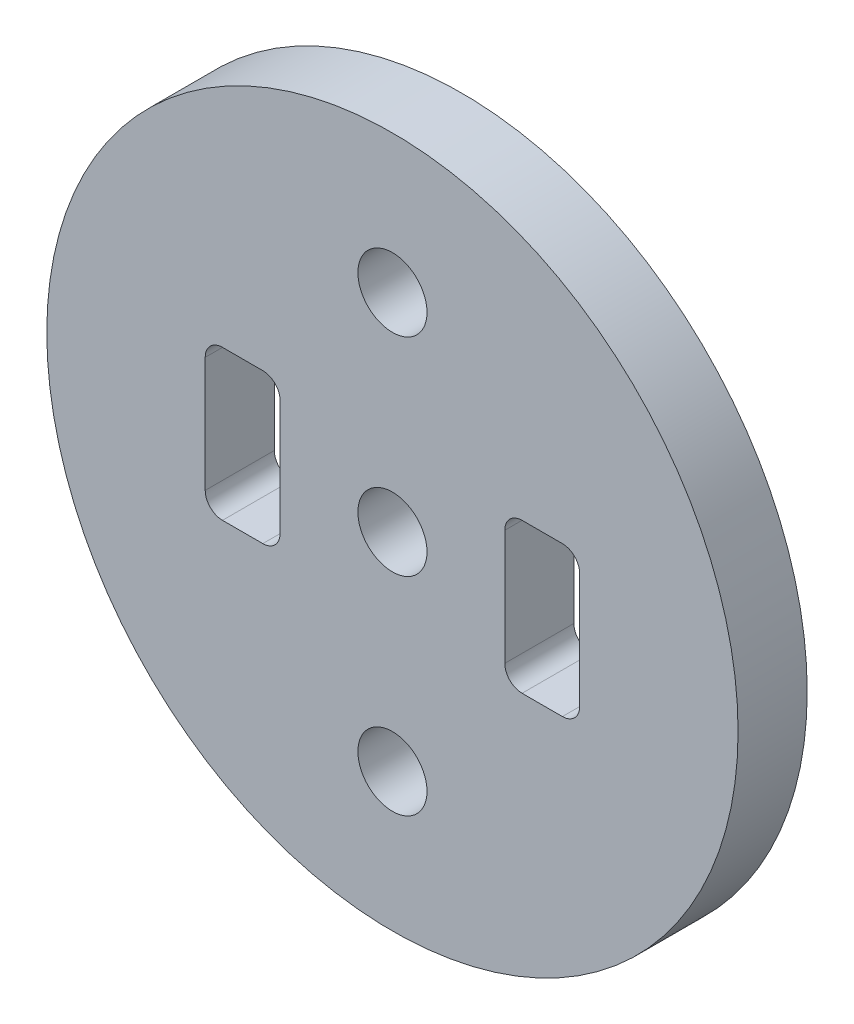
from build123d import *

# Parameters (mm, degrees)
MODEL_R                 = 15
MODEL_R_2               = 1.5
SALIENTE_EXTRUIR1_DEPTH = 3


with BuildPart() as part:
    # Model → Saliente-Extruir1 (new body)
    with BuildSketch(Plane.XY):
        with Locations((215.747807914, 241.952019993)):
            Circle(MODEL_R)
        with Locations((215.747807914, 241.952019993)):
            Circle(MODEL_R_2, mode=Mode.SUBTRACT)
        with Locations((215.747807914, 232.952019993)):
            Circle(MODEL_R_2, mode=Mode.SUBTRACT)
        with Locations((215.747807914, 250.952019993)):
            Circle(MODEL_R_2, mode=Mode.SUBTRACT)
        with BuildLine():
            Line((223.122807913, 245.202019993), (221.372807913, 245.202019993))
            ThreePointArc((221.372807913, 245.202019993), (220.842477828, 244.982350079), (220.622807913, 244.452019993))
            Line((220.622807913, 244.452019993), (220.622807913, 239.452019993))
            ThreePointArc((220.622807913, 239.452019993), (220.842477828, 238.921689907), (221.372807913, 238.702019993))
            Line((221.372807913, 238.702019993), (223.122807913, 238.702019993))
            ThreePointArc((223.122807913, 238.702019993), (223.653137999, 238.921689907), (223.872807913, 239.452019993))
            Line((223.872807913, 239.452019993), (223.872807913, 244.452019993))
            ThreePointArc((223.872807913, 244.452019993), (223.653137999, 244.982350079), (223.122807913, 245.202019993))
        make_face(mode=Mode.SUBTRACT)
        with BuildLine():
            Line((208.372807913, 245.202019993), (210.122807913, 245.202019993))
            ThreePointArc((210.122807913, 245.202019993), (210.653137999, 244.982350079), (210.872807913, 244.452019993))
            Line((210.872807913, 244.452019993), (210.872807913, 239.452019993))
            ThreePointArc((210.872807913, 239.452019993), (210.653137999, 238.921689907), (210.122807913, 238.702019993))
            Line((210.122807913, 238.702019993), (208.372807913, 238.702019993))
            ThreePointArc((208.372807913, 238.702019993), (207.842477828, 238.921689907), (207.622807913, 239.452019993))
            Line((207.622807913, 239.452019993), (207.622807913, 244.452019993))
            ThreePointArc((207.622807913, 244.452019993), (207.842477828, 244.982350079), (208.372807913, 245.202019993))
        make_face(mode=Mode.SUBTRACT)
    extrude(amount=SALIENTE_EXTRUIR1_DEPTH)


solid = part.part
